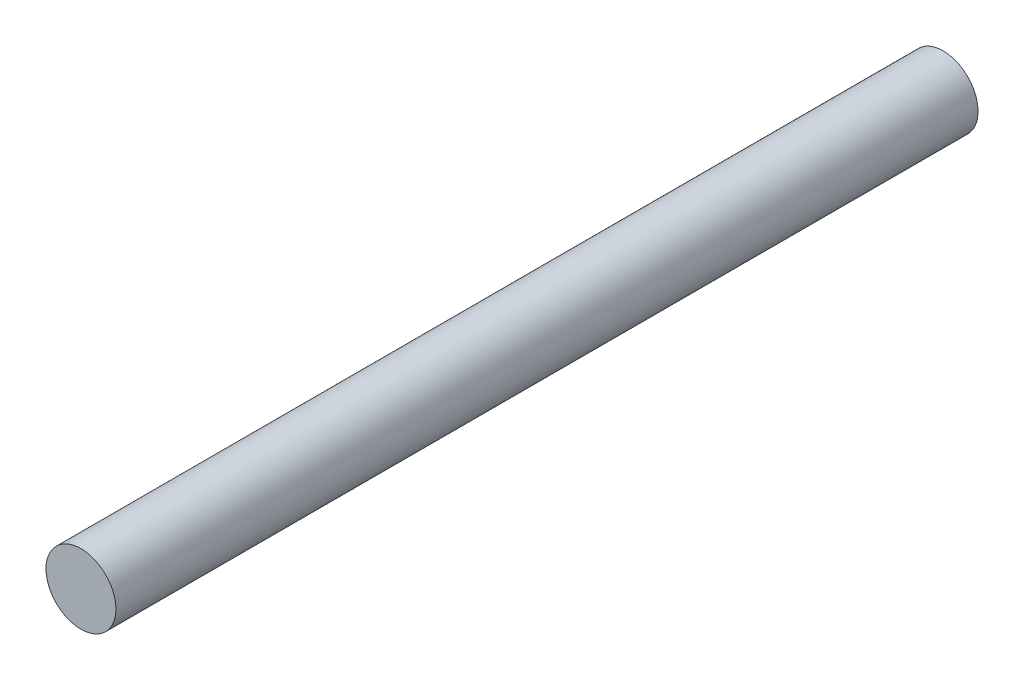
from build123d import *

# Parameters (mm, degrees)
ESQUISSE2_R        = 49.403
BOSS_EXTRU_1_DEPTH = 1219.2


with BuildPart() as part:
    # Esquisse2 → Boss.-Extru.1 (new body)
    with BuildSketch(Plane.XY):
        with Locations(Location((0, 0, 0), (0, 0, 180))):
            Circle(ESQUISSE2_R)
    extrude(amount=BOSS_EXTRU_1_DEPTH)


solid = part.part
